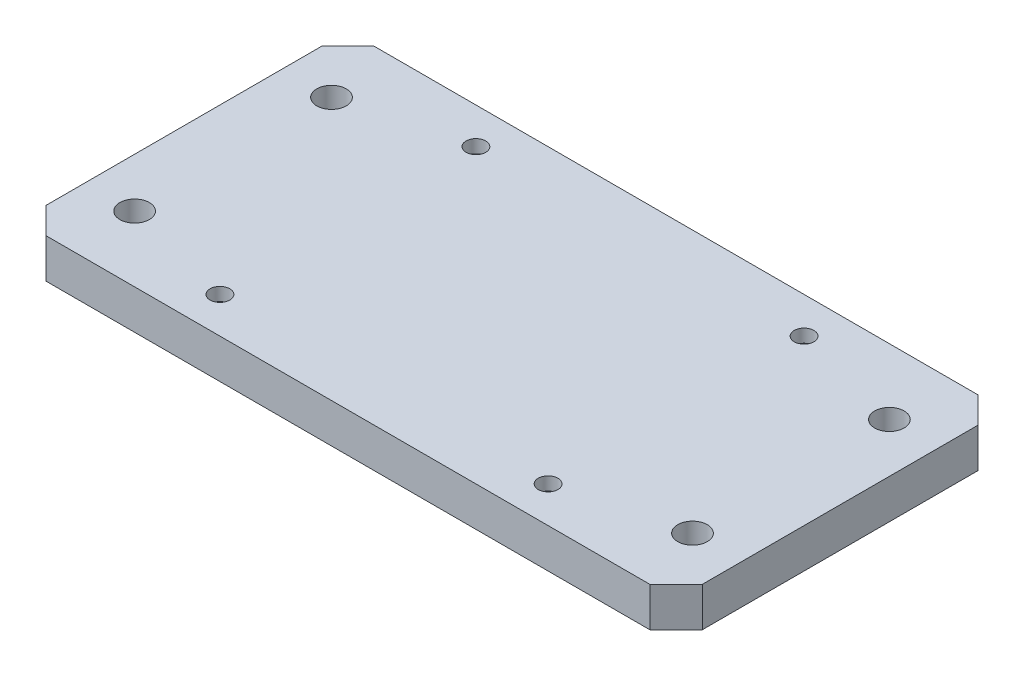
from build123d import *

# Parameters (mm, degrees)
SKETCH1_W                                       = 200
SKETCH1_H                                       = 100
BOSS_EXTRUDE1_DEPTH                             = 12
F_9_0_9_DIAMETER_HOLE1_D                        = 9
CBORE_FOR_M5_SOCKET_HEAD_CAP_SCREW1_D           = 6
CBORE_FOR_M5_SOCKET_HEAD_CAP_SCREW1_CBORE_D     = 11
CBORE_FOR_M5_SOCKET_HEAD_CAP_SCREW1_CBORE_DEPTH = 8
CHAMFER1_SIZE                                   = 8


with BuildPart() as part:
    # Sketch1 → Boss-Extrude1 (new body)
    with BuildSketch(Plane(origin=(0, 0, 0), x_dir=(1, 0, 0), z_dir=(0, 1, 0))):
        with Locations((-100, 0)):
            Rectangle(SKETCH1_W, SKETCH1_H)
    extrude(amount=BOSS_EXTRUDE1_DEPTH)

    # Ø9.0 (9) Diameter Hole1 (through all)
    with Locations(Plane(origin=(0, 12, 0), x_dir=(-1, 0, 0), z_dir=(0, 1, 0))):
        with Locations((185, 30), (15, 30), (15, -30), (185, -30)):
            Hole(F_9_0_9_DIAMETER_HOLE1_D / 2)

    # CBORE for M5 Socket Head Cap Screw1 (through all)
    with Locations(Plane.XZ):
        with Locations((-150, 39), (-50, 39), (-150, -39), (-50, -39)):
            CounterBoreHole(CBORE_FOR_M5_SOCKET_HEAD_CAP_SCREW1_D / 2, CBORE_FOR_M5_SOCKET_HEAD_CAP_SCREW1_CBORE_D / 2, CBORE_FOR_M5_SOCKET_HEAD_CAP_SCREW1_CBORE_DEPTH)

    # Chamfer1
    chamfer1_edges = [part.edges().sort_by_distance(p)[0] for p in [
        (-200, 6, -50),
        (0, 6, -50),
        (0, 6, 50),
        (-200, 6, 50),
    ]]
    chamfer(chamfer1_edges, length=CHAMFER1_SIZE)


solid = part.part
